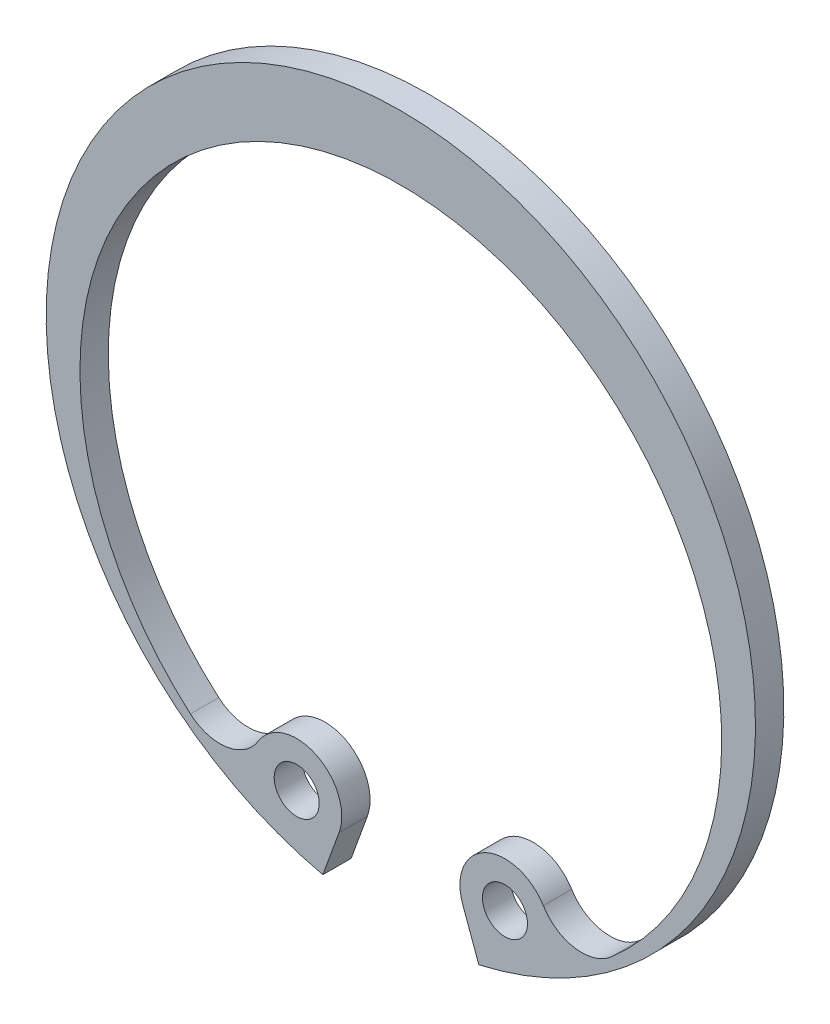
from build123d import *
from build123d.topology import SkipClean

# Parameters (mm, degrees)
SKETCH1_R                 = 14.7
EXTRUDE1_DEPTH            = 1.175
SKETCH34_R                = 0.933333333
F_056_250_SNAP_RING_DEPTH = 1.175
SKETCH35_R                = 14.7
CUT_EXTRUDE1_DEPTH        = 1.175


with BuildPart() as part:
    # Sketch1 → Extrude1 (new body)
    with BuildSketch(Plane.XY):
        Circle(SKETCH1_R)
    extrude(amount=EXTRUDE1_DEPTH)

    # Sketch34 → 056-250 Snap Ring (add)
    with SkipClean():  # the faces are left unmerged after this step: merging them gives an invalid solid
        with BuildSketch(Plane.XY.offset(1.175)):
            with BuildLine():
                Line((-2.561684509, -12.495938559), (-3.232902754, -14.340095529))
                ThreePointArc((-3.232902754, -14.340095529), (0, 14.7), (3.232902754, -14.340095529))
                Line((3.232902754, -14.340095529), (2.561684509, -12.495938559))
                ThreePointArc((2.561684509, -12.495938559), (3.503731248, -10.176719744), (5.906115896, -10.880122876))
                ThreePointArc((5.906115896, -10.880122876), (7.213198298, -11.747795045), (8.720365313, -11.312172515))
                ThreePointArc((8.720365313, -11.312172515), (0, 12.03), (-8.720365313, -11.312172515))
                ThreePointArc((-8.720365313, -11.312172515), (-7.213198298, -11.747795045), (-5.906115896, -10.880122876))
                ThreePointArc((-5.906115896, -10.880122876), (-3.503731248, -10.176719744), (-2.561684509, -12.495938559))
            make_face()
            with Locations((4.315777401, -11.857500958)):
                Circle(SKETCH34_R, mode=Mode.SUBTRACT)
            with Locations((-4.315777401, -11.857500958)):
                Circle(SKETCH34_R, mode=Mode.SUBTRACT)
        extrude(amount=F_056_250_SNAP_RING_DEPTH)

    # Sketch35 → Cut-Extrude1 (cut)
    with BuildSketch(Plane(origin=(0, 0, 0), x_dir=(-1, 0, 0), z_dir=(0, 0, -1))):
        Circle(SKETCH35_R)
    extrude(amount=-CUT_EXTRUDE1_DEPTH, mode=Mode.SUBTRACT)


solid = part.part
